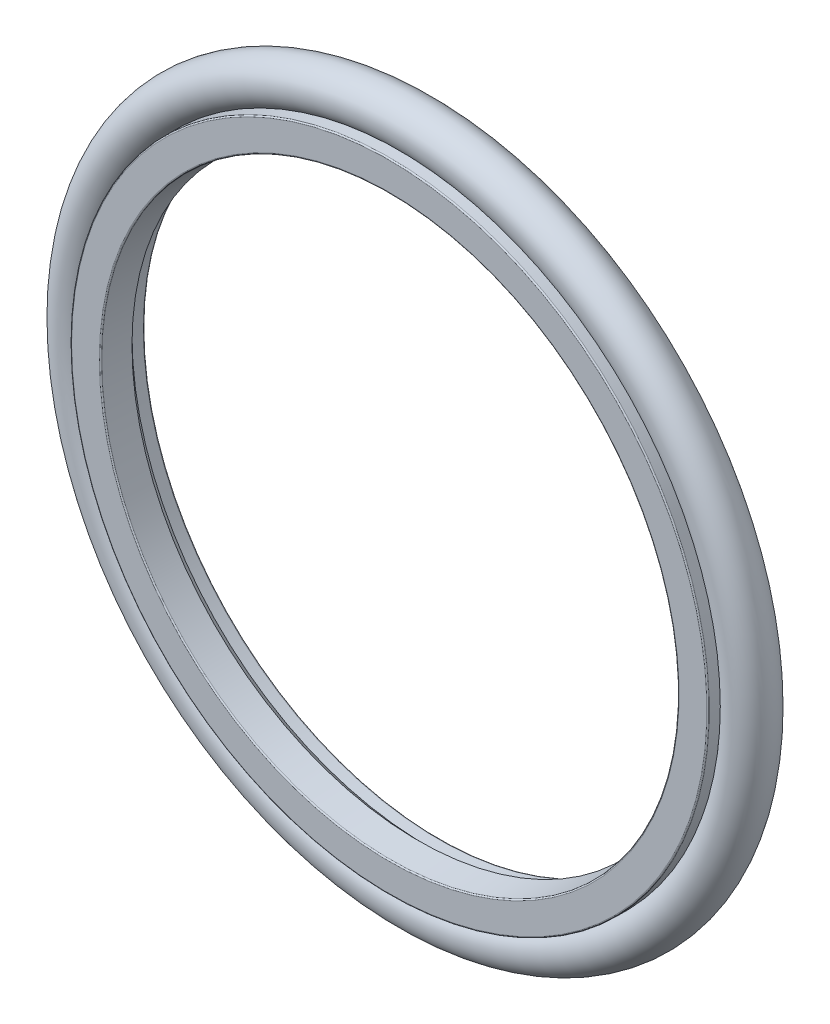
from build123d import *

# Parameters (mm, degrees)
SKETCH4_R = 1.765


with BuildPart() as part:
    # Sketch1 → Revolve1 (revolve)
    with BuildSketch(Plane(origin=(0, 0, 0), x_dir=(0, 0, -1), z_dir=(1, 0, 0)), mode=Mode.PRIVATE) as revolve1_sk:
        with BuildLine():
            Line((0, 23.55), (0, 25.25))
            ThreePointArc((0, 25.25), (-0.029289322, 25.320710678), (-0.1, 25.35))
            Line((-0.1, 25.35), (-3.9, 25.35))
            ThreePointArc((-3.9, 25.35), (-3.970710678, 25.320710678), (-4, 25.25))
            Line((-4, 25.25), (-4, 23.041681708))
            ThreePointArc((-4, 23.041681708), (-3.973709891, 22.974103221), (-3.908662962, 22.942057649))
            Line((-3.908662962, 22.942057649), (-1.7, 22.75))
            Line((-1.7, 22.75), (-1, 23.45))
            Line((-1, 23.45), (-0.1, 23.45))
            ThreePointArc((-0.1, 23.45), (-0.029289322, 23.479289322), (0, 23.55))
        make_face()
    revolve(revolve1_sk.sketch.rotate(Axis((0, 0, 0), (0, 0, 1)), 90), axis=Axis((0, 0, 0), (0, 0, 1)))


with BuildPart() as body_2:
    # Sketch4 → Revolve2 (revolve)
    with BuildSketch(Plane(origin=(0, 0, 0), x_dir=(0, 0, -1), z_dir=(1, 0, 0)), mode=Mode.PRIVATE) as revolve2_sk:
        with Locations((-1.95, 26.765)):
            Circle(SKETCH4_R)
    revolve(revolve2_sk.sketch.rotate(Axis((0, 0, 0), (0, 0, 1)), 90), axis=Axis((0, 0, 0), (0, 0, 1)))


solid = Compound([part.part, body_2.part])
